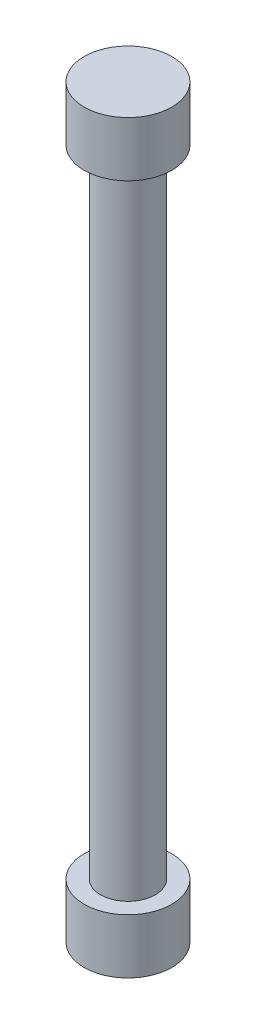
from build123d import *

# Parameters (mm, degrees)
SKETCH1_R           = 2.5
BOSS_EXTRUDE1_DEPTH = 58
SKETCH2_R           = 4
BOSS_EXTRUDE2_DEPTH = 5
BOSS_EXTRUDE3_START = -63
SKETCH3_R           = 4
BOSS_EXTRUDE3_DEPTH = 5


with BuildPart() as part:
    # Sketch1 → Boss-Extrude1 (new body)
    with BuildSketch(Plane(origin=(0, 0, 0), x_dir=(1, 0, 0), z_dir=(0, 1, 0))):
        with Locations(Location((0, 0, 0), (0, 0, 270))):
            Circle(SKETCH1_R)
    extrude(amount=-BOSS_EXTRUDE1_DEPTH)

    # Sketch2 → Boss-Extrude2 (add)
    with BuildSketch(Plane(origin=(0, 0, 0), x_dir=(1, 0, 0), z_dir=(0, 1, 0))):
        with Locations(Location((0, 0, 0), (0, 0, 270))):
            Circle(SKETCH2_R)
    extrude(amount=BOSS_EXTRUDE2_DEPTH)

    # Sketch3 → Boss-Extrude3 (add)
    with BuildSketch(Plane(origin=(0, 0, 0), x_dir=(1, 0, 0), z_dir=(0, 1, 0)).offset(BOSS_EXTRUDE3_START)):
        with Locations(Location((0, 0, 0), (0, 0, 270))):
            Circle(SKETCH3_R)
    extrude(amount=BOSS_EXTRUDE3_DEPTH)


solid = part.part
